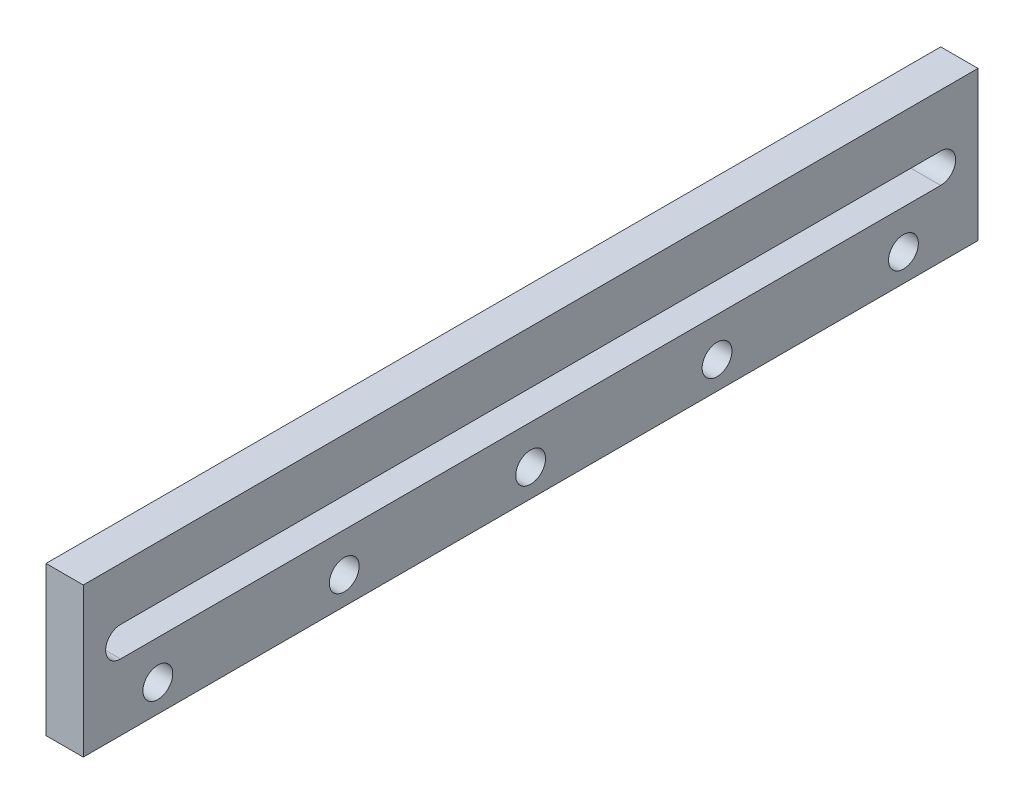
from build123d import *

# Parameters (mm, degrees)
EXTRUDE_1_DEPTH = 5


with BuildPart() as part:
    # 草图2 → 凸台-拉伸1 (new body)
    # profile 1 of 2: a face of its own
    with BuildSketch(Plane(origin=(0, 0, 0), x_dir=(0, 0, -1), z_dir=(1, 0, 0))):
        with BuildLine():
            ThreePointArc((-52, -6.305745823), (-50, -4.305745823), (-48, -6.305745823))
            Line((-48, -6.305745823), (-27, -6.305745823))
            ThreePointArc((-27, -6.305745823), (-25, -4.305745823), (-23, -6.305745823))
            Line((-23, -6.305745823), (-2, -6.305745823))
            ThreePointArc((-2, -6.305745823), (0, -4.305745823), (2, -6.305745823))
            Line((2, -6.305745823), (23, -6.305745823))
            ThreePointArc((23, -6.305745823), (25, -4.305745823), (27, -6.305745823))
            Line((27, -6.305745823), (48, -6.305745823))
            ThreePointArc((48, -6.305745823), (50, -4.305745823), (52, -6.305745823))
            Line((52, -6.305745823), (60, -6.305745823))
            Line((60, -6.305745823), (60, 10))
            Line((60, 10), (-60, 10))
            Line((-60, 10), (-60, -6.305745823))
            Line((-60, -6.305745823), (-52, -6.305745823))
        make_face()
        with BuildLine():
            Line((55, -1.09255297), (-55, -1.09255297))
            ThreePointArc((-55, -1.09255297), (-57, 0.90744703), (-55, 2.90744703))
            Line((-55, 2.90744703), (55, 2.90744703))
            ThreePointArc((55, 2.90744703), (57, 0.90744703), (55, -1.09255297))
        make_face(mode=Mode.SUBTRACT)
    # profile 2 of 2: a face of its own
    with BuildSketch(Plane(origin=(0, 0, 0), x_dir=(0, 0, -1), z_dir=(1, 0, 0))):
        with BuildLine():
            Line((-27, -6.305745823), (-48, -6.305745823))
            ThreePointArc((-48, -6.305745823), (-50, -8.305745823), (-52, -6.305745823))
            Line((-52, -6.305745823), (-60, -6.305745823))
            Line((-60, -6.305745823), (-60, -10))
            Line((-60, -10), (60, -10))
            Line((60, -10), (60, -6.305745823))
            Line((60, -6.305745823), (52, -6.305745823))
            ThreePointArc((52, -6.305745823), (50, -8.305745823), (48, -6.305745823))
            Line((48, -6.305745823), (27, -6.305745823))
            ThreePointArc((27, -6.305745823), (25, -8.305745823), (23, -6.305745823))
            Line((23, -6.305745823), (2, -6.305745823))
            ThreePointArc((2, -6.305745823), (0, -8.305745823), (-2, -6.305745823))
            Line((-2, -6.305745823), (-23, -6.305745823))
            ThreePointArc((-23, -6.305745823), (-25, -8.305745823), (-27, -6.305745823))
        make_face()
    extrude(amount=EXTRUDE_1_DEPTH)


solid = part.part
